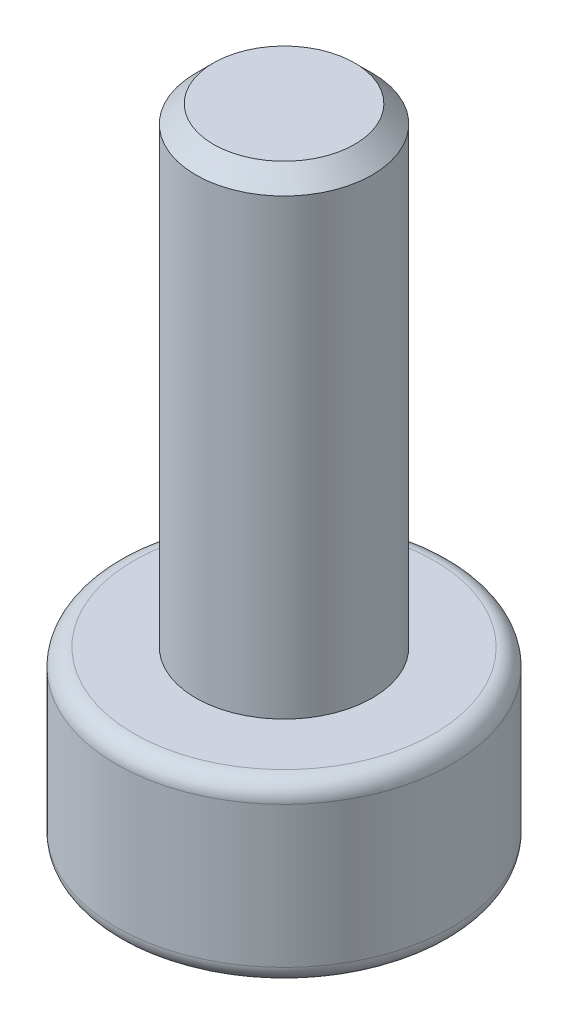
from build123d import *

# Parameters (mm, degrees)
SKETCH_1_R          = 2.85
EXTRUDE_1_DEPTH     = 3
SKETCH_2_R          = 1.5
EXTRUDE_2_DEPTH     = 8
SKETCH_3_R          = 1.29
CUT_EXTRUDE_1_DEPTH = 1.3
FILLET_1_R          = 0.3
CHAMFER_1_SIZE      = 0.3
CHAMFER_2_SIZE      = 0.15


with BuildPart() as part:
    # 草图1 → 凸台-拉伸1 (new body)
    with BuildSketch(Plane(origin=(0, 0, 0), x_dir=(1, 0, 0), z_dir=(0, 1, 0))):
        with Locations(Location((0, 0, 0), (0, 0, 270))):
            Circle(SKETCH_1_R)
    extrude(amount=EXTRUDE_1_DEPTH)

    # 草图2 → 凸台-拉伸2 (add)
    with BuildSketch(Plane(origin=(0, 3, 0), x_dir=(1, 0, 0), z_dir=(0, 1, 0))):
        with Locations(Location((0, 0, 0), (0, 0, 270))):
            Circle(SKETCH_2_R)
    extrude(amount=EXTRUDE_2_DEPTH)

    # 草图3 → 切除-拉伸1 (cut)
    with BuildSketch(Plane.XZ):
        with Locations(Location((0, 0, 0), (0, 0, 270))):
            Circle(SKETCH_3_R)
    extrude(amount=-CUT_EXTRUDE_1_DEPTH, mode=Mode.SUBTRACT)

    # 圆角1
    fillet_1_edges = [part.edges().sort_by_distance(p)[0] for p in [
        (0, 0, -2.85),
        (0, 3, -2.85),
    ]]
    fillet(fillet_1_edges, radius=FILLET_1_R)

    # 倒角1
    chamfer_1_edges = [part.edges().sort_by_distance(p)[0] for p in [
        (0, 11, -1.5),
    ]]
    chamfer(chamfer_1_edges, length=CHAMFER_1_SIZE)

    # 倒角2
    chamfer_2_edges = [part.edges().sort_by_distance(p)[0] for p in [
        (0, 0, 1.29),
    ]]
    chamfer(chamfer_2_edges, length=CHAMFER_2_SIZE)


solid = part.part
